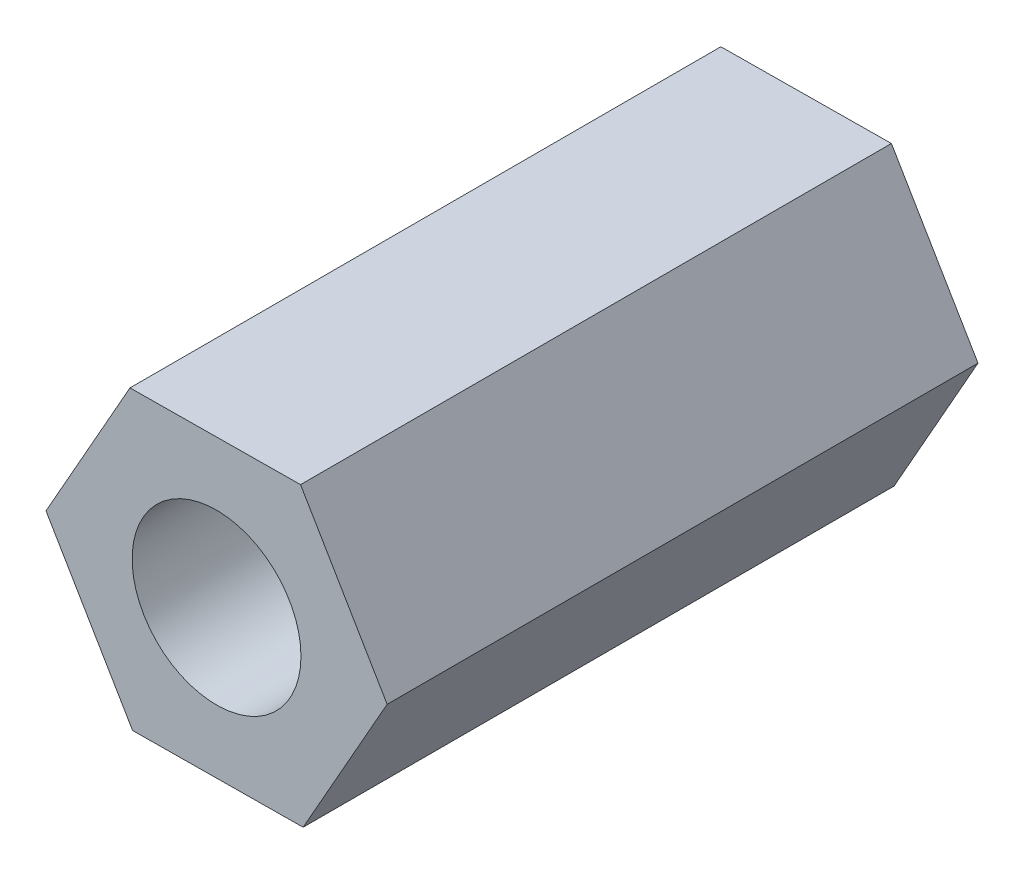
from build123d import *

# Parameters (mm, degrees)
SKETCH_1_R      = 2
EXTRUDE_1_DEPTH = 14


with BuildPart() as part:
    # 草图1 → 凸台-拉伸1 (new body)
    with BuildSketch(Plane.XY):
        Polygon((2.051456248, -3.482077052), (4.041295309, 0.035574699), (1.989839061, 3.517651751), (-2.051456248, 3.482077052), (-4.041295309, -0.035574699), (-1.989839061, -3.517651751), align=None)
        Circle(SKETCH_1_R, mode=Mode.SUBTRACT)
    extrude(amount=EXTRUDE_1_DEPTH)


solid = part.part
